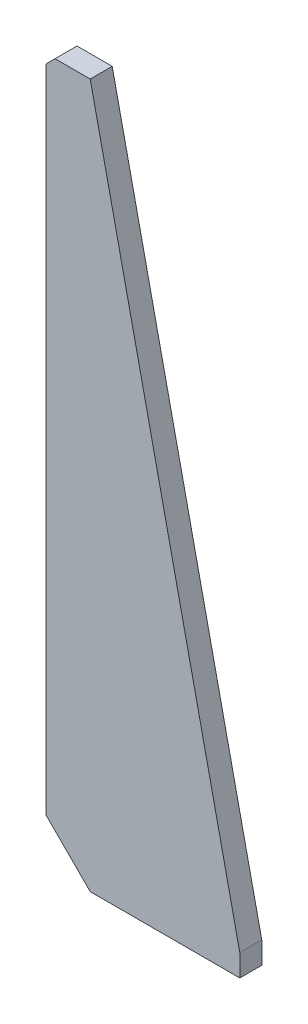
from build123d import *

# Parameters (mm, degrees)
EXTRUDE_1_DEPTH = 2.5
CHAMFER_1_SIZE  = 10
CHAMFER_2_SIZE  = 2


with BuildPart() as part:
    # Эскиз1 → Бобышка-Вытянуть1 (new, symmetric)
    with BuildSketch(Plane.XY):
        Polygon((0, 0), (0, 160), (10, 160), (44, 5), (44, 0), align=None)
    extrude(amount=EXTRUDE_1_DEPTH, both=True)

    # Фаска1
    chamfer_1_edges = [part.edges().sort_by_distance(p)[0] for p in [
        (0, 0, 0),
    ]]
    chamfer(chamfer_1_edges, length=CHAMFER_1_SIZE)

    # Фаска2
    chamfer_2_edges = [part.edges().sort_by_distance(p)[0] for p in [
        (0, 160, 0),
    ]]
    chamfer(chamfer_2_edges, length=CHAMFER_2_SIZE)


solid = part.part
